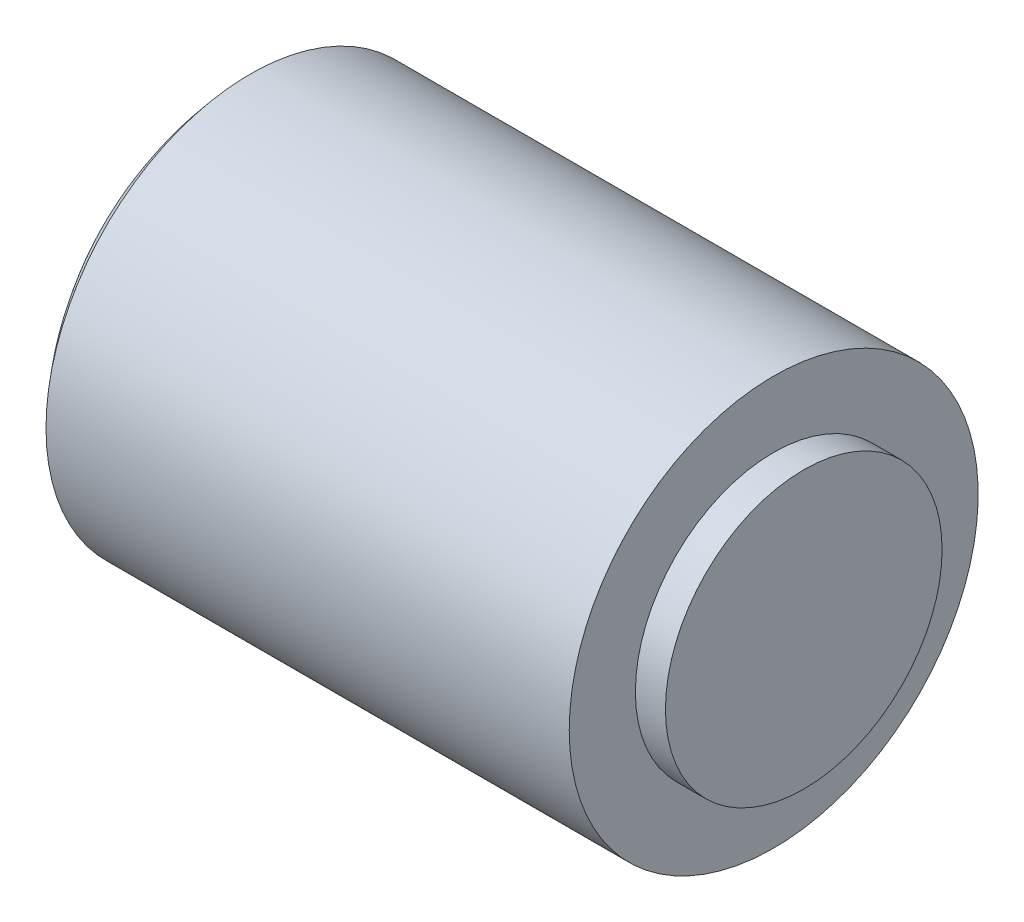
from build123d import *


with BuildPart() as part:
    # Sketch1 → Revolve1 (revolve)
    with BuildSketch(Plane(origin=(0, 0, 0), x_dir=(1, 0, 0), z_dir=(0, 1, 0)), mode=Mode.PRIVATE) as revolve1_sk:
        with BuildLine():
            Line((87, 23), (92, 23))
            Line((92, 23), (92, 0))
            Line((92, 0), (87, 0))
            Line((87, 0), (0, 0))
            Line((0, 0), (-13, 0))
            ThreePointArc((-13, 0), (-9.639180045, 18.200274723), (0, 34))
            Line((0, 34), (87, 34))
            Line((87, 34), (87, 23))
        make_face()
    revolve(revolve1_sk.sketch.rotate(Axis((0, 0, 0), (1, 0, 0)), 180), axis=Axis((0, 0, 0), (1, 0, 0)))


solid = part.part
